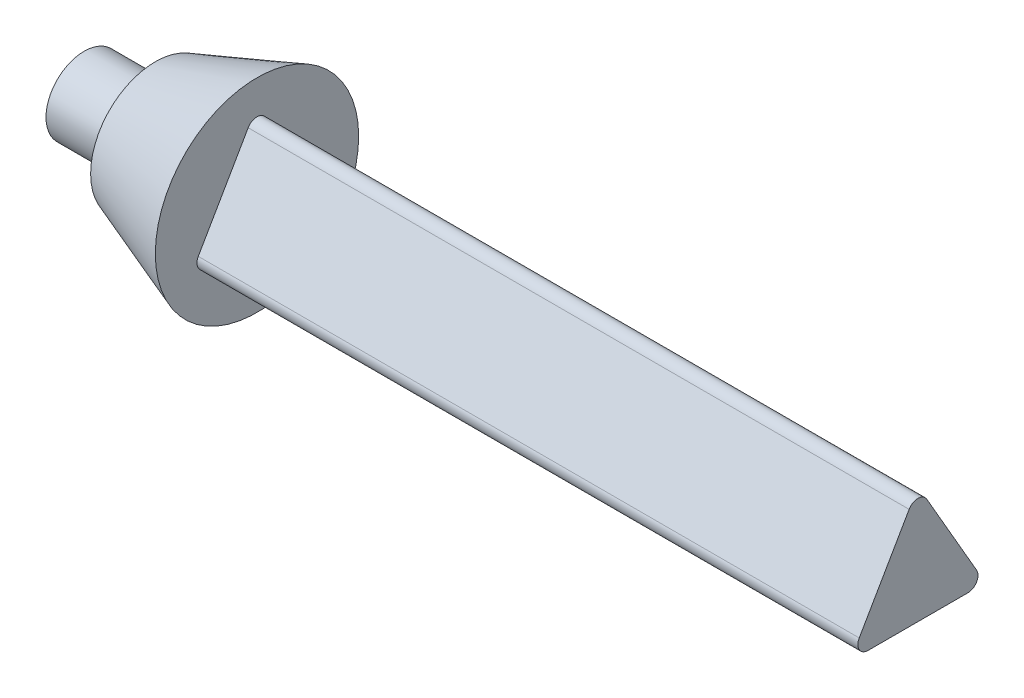
from build123d import *

# Parameters (mm, degrees)
BOSS_EXTRUDE1_DEPTH = 13
SKETCH3_R           = 0.75
BOSS_EXTRUDE2_DEPTH = 1.4
FILLET1_R           = 0.2


with BuildPart() as part:
    # Sketch1 → Revolve1 (revolve)
    with BuildSketch(Plane.XY, mode=Mode.PRIVATE) as revolve1_sk:
        Polygon((0, 0), (0, 2), (-2, 1.272059531), (-2, 0), align=None)
    revolve(revolve1_sk.sketch.rotate(Axis((-2, 0, 0), (1, 0, 0)), 90), axis=Axis((-2, 0, 0), (1, 0, 0)))

    # Sketch2 → Boss-Extrude1 (add)
    with BuildSketch(Plane(origin=(0, 0, 0), x_dir=(0, 0, -1), z_dir=(1, 0, 0))):
        Polygon((0, 1.533333333), (-1.327905619, -0.766666667), (1.327905619, -0.766666667), align=None)
    extrude(amount=BOSS_EXTRUDE1_DEPTH)

    # Sketch3 → Boss-Extrude2 (add)
    with BuildSketch(Plane.ZY.offset(2)):
        Circle(SKETCH3_R)
    extrude(amount=BOSS_EXTRUDE2_DEPTH)

    # Fillet1
    fillet1_edges = [part.edges().sort_by_distance(p)[0] for p in [
        (6.5, -0.766666667, -1.327905619),
        (6.5, 1.533333333, 0),
        (6.5, -0.766666667, 1.327905619),
    ]]
    fillet(fillet1_edges, radius=FILLET1_R)


solid = part.part
